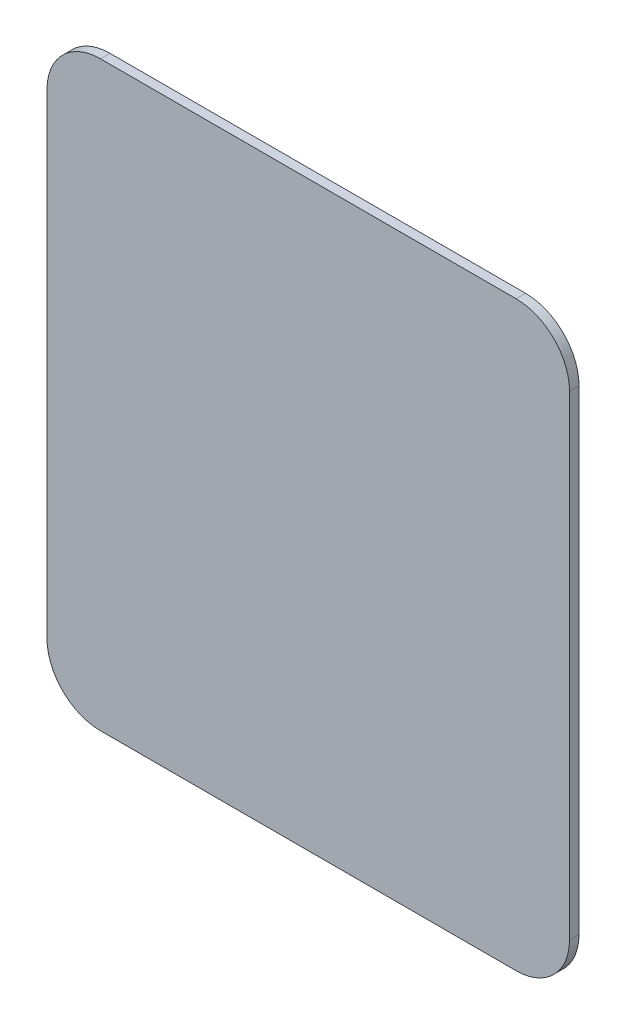
from build123d import *

# Parameters (mm, degrees)
SKETCH1_W           = 88
SKETCH1_H           = 98
BOSS_EXTRUDE1_DEPTH = 1.6
FILLET1_R           = 9


with BuildPart() as part:
    # Sketch1 → Boss-Extrude1 (new body)
    with BuildSketch(Plane.XY):
        with Locations((-76.472694805, 1.282636737)):
            Rectangle(SKETCH1_W, SKETCH1_H)
    extrude(amount=BOSS_EXTRUDE1_DEPTH)

    # Fillet1
    fillet1_edges = [part.edges().sort_by_distance(p)[0] for p in [
        (-120.472694805, 50.282636737, 0.8),
        (-32.472694805, 50.282636737, 0.8),
        (-32.472694805, -47.717363263, 0.8),
        (-120.472694805, -47.717363263, 0.8),
    ]]
    fillet(fillet1_edges, radius=FILLET1_R)


solid = part.part
